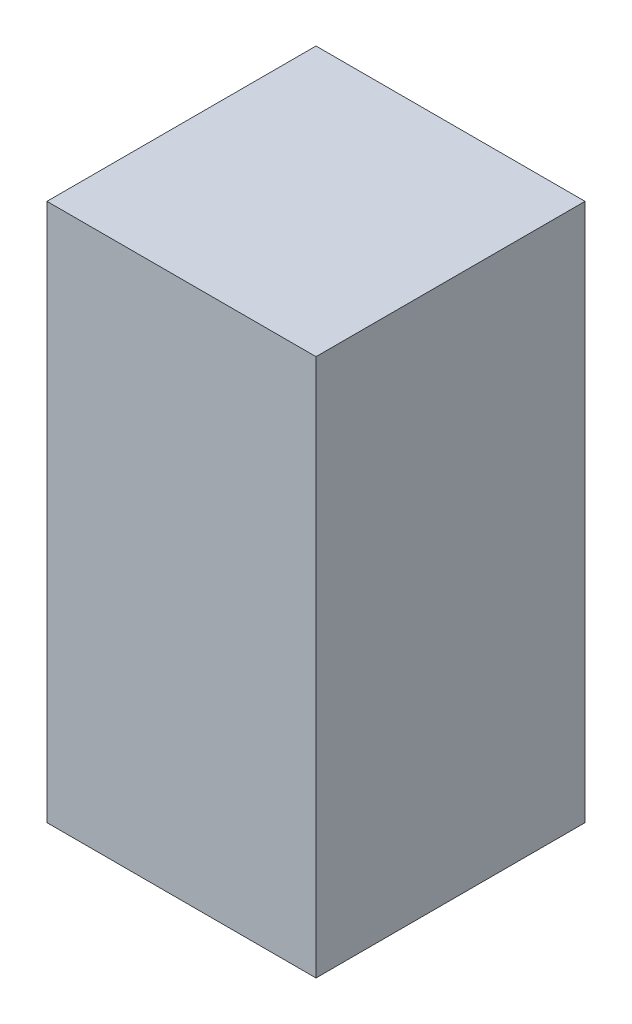
from build123d import *

# Parameters (mm, degrees)
SKETCH1_W           = 150
SKETCH1_H           = 150
BOSS_EXTRUDE1_DEPTH = 300


with BuildPart() as part:
    # Sketch1 → Boss-Extrude1 (new body)
    with BuildSketch(Plane(origin=(0, 0, 0), x_dir=(1, 0, 0), z_dir=(0, 1, 0))):
        Rectangle(SKETCH1_W, SKETCH1_H)
    extrude(amount=BOSS_EXTRUDE1_DEPTH)


solid = part.part
